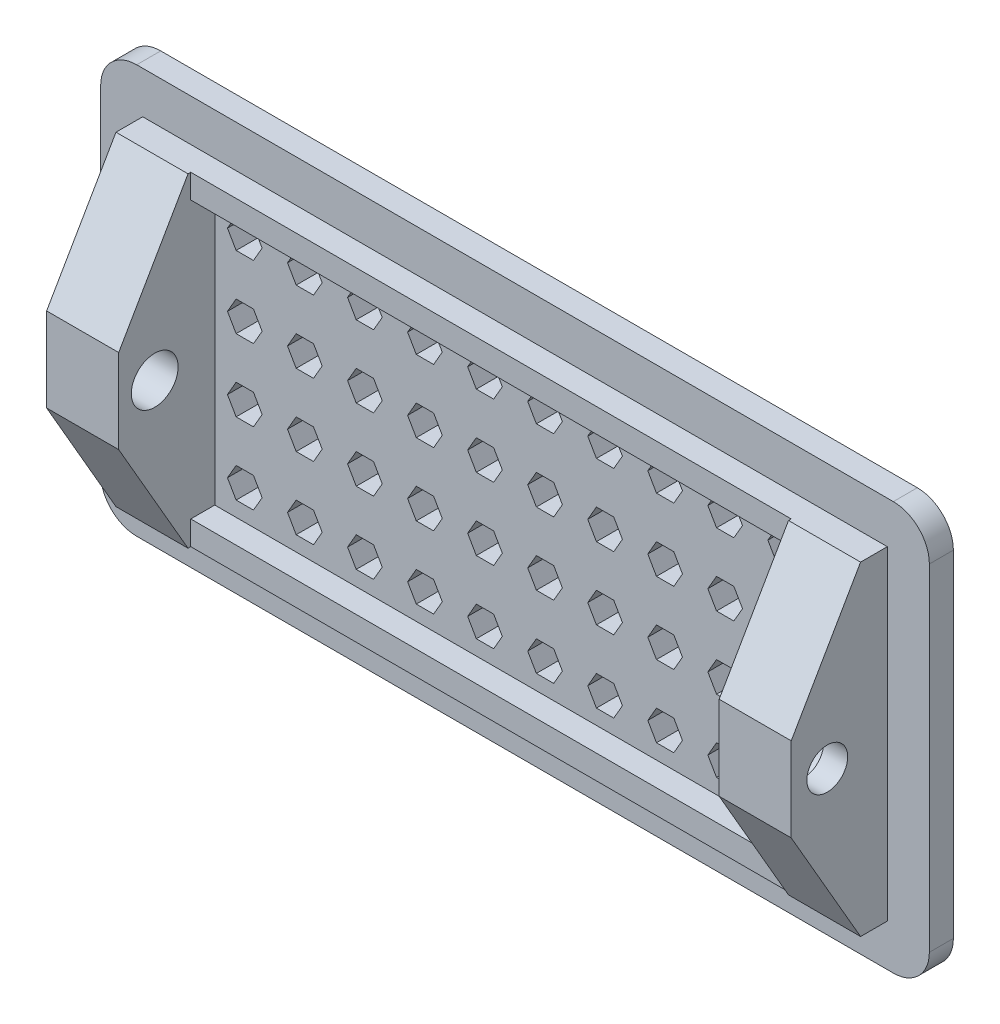
from build123d import *
from OCP.BRepFilletAPI import BRepFilletAPI_MakeChamfer

# Parameters (mm, degrees)
SKICA1_W                                          = 69
SKICA1_H                                          = 34
P_IDAT_VYSUNUT_M1_DEPTH                           = 2
SKICA2_W                                          = 50
SKICA2_H                                          = 2
P_IDAT_VYSUNUT_M2_DEPTH                           = 2
P_IDAT_VYSUNUT_M3_DEPTH                           = 8
V_LCOV_ZAHLOUBEN_PRO_M3_ROUBY_S_V_LCO_D           = 3.4
V_LCOV_ZAHLOUBEN_PRO_M3_ROUBY_S_V_LCO_DEPTH       = 6.001
V_LCOV_ZAHLOUBEN_PRO_M3_ROUBY_S_V_LCO_CBORE_D     = 3.9
V_LCOV_ZAHLOUBEN_PRO_M3_ROUBY_S_V_LCO_CBORE_DEPTH = 4
ZKOSEN_1_SIZE                                     = 10
ZKOSEN_1_SIZE2                                    = 5.773502692
ZKOSEN_2_SIZE                                     = 10
ZKOSEN_2_SIZE2                                    = 5.773502692
ZAOBLIT1_R                                        = 3
ODEBRAT_VYSUNUT_M1_DEPTH                          = 10


with BuildPart() as part:
    # Skica1 → Přidat vysunutím1 (new body)
    with BuildSketch(Plane.XY):
        Rectangle(SKICA1_W, SKICA1_H)
    extrude(amount=P_IDAT_VYSUNUT_M1_DEPTH)

    # Skica2 → Přidat vysunutím2 (add)
    with BuildSketch(Plane.XY.offset(2)):
        with Locations((0, -12.5)):
            Rectangle(SKICA2_W, SKICA2_H)
        with Locations((0, 12.5)):
            Rectangle(SKICA2_W, SKICA2_H)
    extrude(amount=P_IDAT_VYSUNUT_M2_DEPTH)

    # Skica2<3> → Přidat vysunutím3 (add)
    with BuildSketch(Plane.XY.offset(2)):
        Polygon((-25, 13.5), (-31, 13.5), (-31, -13.5), (-25, -13.5), (-25, -11.5), (-25, 11.5), align=None)
        Polygon((31, 13.5), (25, 13.5), (25, 11.5), (25, -11.5), (25, -13.5), (31, -13.5), align=None)
    extrude(amount=P_IDAT_VYSUNUT_M3_DEPTH)

    # Válcové zahloubení pro M3 šrouby s válcovou hlavou zaoblenou1
    with Locations(Plane(origin=(-25, 0, 0), x_dir=(0, 0, -1), z_dir=(1, 0, 0))):
        with Locations((-7, 0)):
            v_lcov_zahlouben_pro_m3_rouby_s_v_lco = CounterBoreHole(V_LCOV_ZAHLOUBEN_PRO_M3_ROUBY_S_V_LCO_D / 2, V_LCOV_ZAHLOUBEN_PRO_M3_ROUBY_S_V_LCO_CBORE_D / 2, V_LCOV_ZAHLOUBEN_PRO_M3_ROUBY_S_V_LCO_CBORE_DEPTH, depth=V_LCOV_ZAHLOUBEN_PRO_M3_ROUBY_S_V_LCO_DEPTH)

    # Zrcadlit1: Válcové zahloubení pro M3 šrouby s válcovou hlavou zaoblenou1 across plane
    add(v_lcov_zahlouben_pro_m3_rouby_s_v_lco.mirror(Plane(origin=(0, 0, 0), x_dir=(0, 0, 1), z_dir=(1, 0, 0))), mode=Mode.SUBTRACT)

    # Zkosení1: one chamfer whose edges measure the first distance from different faces: ONE call of the kernel's chamfer builder (chamfer() names one face for all edges)
    zkosen_1_edges_1 = [part.edges().sort_by_distance(p)[0] for p in [
        (-28, 13.5, 10),
    ]]
    zkosen_1_side_1 = [part.faces().sort_by_distance(p)[0] for p in [
        (-28, 0, 10),
    ]]
    zkosen_1_edges_2 = [part.edges().sort_by_distance(p)[0] for p in [
        (28, 13.5, 10),
    ]]
    zkosen_1_side_2 = [part.faces().sort_by_distance(p)[0] for p in [
        (28, 0, 10),
    ]]
    zkosen_1 = BRepFilletAPI_MakeChamfer(part.part.solid().wrapped)
    for e in zkosen_1_edges_1:
        zkosen_1.Add(ZKOSEN_1_SIZE, ZKOSEN_1_SIZE2, e.wrapped, zkosen_1_side_1[0].wrapped)  # the first distance lies on this face
    for e in zkosen_1_edges_2:
        zkosen_1.Add(ZKOSEN_1_SIZE, ZKOSEN_1_SIZE2, e.wrapped, zkosen_1_side_2[0].wrapped)  # the first distance lies on this face
    add(Compound.cast(zkosen_1.Shape()), mode=Mode.REPLACE)

    # Zkosení2: one chamfer whose edges measure the first distance from different faces: ONE call of the kernel's chamfer builder (chamfer() names one face for all edges)
    zkosen_2_edges_1 = [part.edges().sort_by_distance(p)[0] for p in [
        (-28, -13.5, 10),
    ]]
    zkosen_2_side_1 = [part.faces().sort_by_distance(p)[0] for p in [
        (-28, -5, 10),
    ]]
    zkosen_2_edges_2 = [part.edges().sort_by_distance(p)[0] for p in [
        (28, -13.5, 10),
    ]]
    zkosen_2_side_2 = [part.faces().sort_by_distance(p)[0] for p in [
        (28, -5, 10),
    ]]
    zkosen_2 = BRepFilletAPI_MakeChamfer(part.part.solid().wrapped)
    for e in zkosen_2_edges_1:
        zkosen_2.Add(ZKOSEN_2_SIZE, ZKOSEN_2_SIZE2, e.wrapped, zkosen_2_side_1[0].wrapped)  # the first distance lies on this face
    for e in zkosen_2_edges_2:
        zkosen_2.Add(ZKOSEN_2_SIZE, ZKOSEN_2_SIZE2, e.wrapped, zkosen_2_side_2[0].wrapped)  # the first distance lies on this face
    add(Compound.cast(zkosen_2.Shape()), mode=Mode.REPLACE)

    # Zaoblit1
    zaoblit1_edges = [part.edges().sort_by_distance(p)[0] for p in [
        (34.5, -17, 1),
        (-34.5, -17, 1),
        (-34.5, 17, 1),
        (34.5, 17, 1),
    ]]
    fillet(zaoblit1_edges, radius=ZAOBLIT1_R)

    # Skica9 → Odebrat vysunutím1 (cut)
    with BuildSketch(Plane.XY.offset(2)):
        Polygon((-21.056624327, -9), (-21.778312164, -7.75), (-23.221687836, -7.75), (-23.943375673, -9), (-23.221687836, -10.25), (-21.778312164, -10.25), align=None)
        Polygon((-16.056624327, -9), (-16.778312164, -7.75), (-18.221687836, -7.75), (-18.943375673, -9), (-18.221687836, -10.25), (-16.778312164, -10.25), align=None)
        Polygon((-11.056624327, -9), (-11.778312164, -7.75), (-13.221687836, -7.75), (-13.943375673, -9), (-13.221687836, -10.25), (-11.778312164, -10.25), align=None)
        Polygon((-6.056624327, -9), (-6.778312164, -7.75), (-8.221687836, -7.75), (-8.943375673, -9), (-8.221687836, -10.25), (-6.778312164, -10.25), align=None)
        Polygon((-1.056624327, -9), (-1.778312164, -7.75), (-3.221687836, -7.75), (-3.943375673, -9), (-3.221687836, -10.25), (-1.778312164, -10.25), align=None)
        Polygon((3.943375673, -9), (3.221687836, -7.75), (1.778312164, -7.75), (1.056624327, -9), (1.778312164, -10.25), (3.221687836, -10.25), align=None)
        Polygon((8.943375673, -9), (8.221687836, -7.75), (6.778312164, -7.75), (6.056624327, -9), (6.778312164, -10.25), (8.221687836, -10.25), align=None)
        Polygon((13.943375673, -9), (13.221687836, -7.75), (11.778312164, -7.75), (11.056624327, -9), (11.778312164, -10.25), (13.221687836, -10.25), align=None)
        Polygon((18.943375673, -9), (18.221687836, -7.75), (16.778312164, -7.75), (16.056624327, -9), (16.778312164, -10.25), (18.221687836, -10.25), align=None)
        Polygon((23.943375673, -9), (23.221687836, -7.75), (21.778312164, -7.75), (21.056624327, -9), (21.778312164, -10.25), (23.221687836, -10.25), align=None)
        Polygon((-16.056624327, -3), (-16.778312164, -1.75), (-18.221687836, -1.75), (-18.943375673, -3), (-18.221687836, -4.25), (-16.778312164, -4.25), align=None)
        Polygon((-11.056624327, -3), (-11.778312164, -1.75), (-13.221687836, -1.75), (-13.943375673, -3), (-13.221687836, -4.25), (-11.778312164, -4.25), align=None)
        Polygon((-6.056624327, -3), (-6.778312164, -1.75), (-8.221687836, -1.75), (-8.943375673, -3), (-8.221687836, -4.25), (-6.778312164, -4.25), align=None)
        Polygon((-1.056624327, -3), (-1.778312164, -1.75), (-3.221687836, -1.75), (-3.943375673, -3), (-3.221687836, -4.25), (-1.778312164, -4.25), align=None)
        Polygon((3.943375673, -3), (3.221687836, -1.75), (1.778312164, -1.75), (1.056624327, -3), (1.778312164, -4.25), (3.221687836, -4.25), align=None)
        Polygon((8.943375673, -3), (8.221687836, -1.75), (6.778312164, -1.75), (6.056624327, -3), (6.778312164, -4.25), (8.221687836, -4.25), align=None)
        Polygon((13.943375673, -3), (13.221687836, -1.75), (11.778312164, -1.75), (11.056624327, -3), (11.778312164, -4.25), (13.221687836, -4.25), align=None)
        Polygon((18.943375673, -3), (18.221687836, -1.75), (16.778312164, -1.75), (16.056624327, -3), (16.778312164, -4.25), (18.221687836, -4.25), align=None)
        Polygon((23.943375673, -3), (23.221687836, -1.75), (21.778312164, -1.75), (21.056624327, -3), (21.778312164, -4.25), (23.221687836, -4.25), align=None)
        Polygon((-16.056624327, 3), (-16.778312164, 4.25), (-18.221687836, 4.25), (-18.943375673, 3), (-18.221687836, 1.75), (-16.778312164, 1.75), align=None)
        Polygon((-11.056624327, 3), (-11.778312164, 4.25), (-13.221687836, 4.25), (-13.943375673, 3), (-13.221687836, 1.75), (-11.778312164, 1.75), align=None)
        Polygon((-6.056624327, 3), (-6.778312164, 4.25), (-8.221687836, 4.25), (-8.943375673, 3), (-8.221687836, 1.75), (-6.778312164, 1.75), align=None)
        Polygon((-1.056624327, 3), (-1.778312164, 4.25), (-3.221687836, 4.25), (-3.943375673, 3), (-3.221687836, 1.75), (-1.778312164, 1.75), align=None)
        Polygon((3.943375673, 3), (3.221687836, 4.25), (1.778312164, 4.25), (1.056624327, 3), (1.778312164, 1.75), (3.221687836, 1.75), align=None)
        Polygon((8.943375673, 3), (8.221687836, 4.25), (6.778312164, 4.25), (6.056624327, 3), (6.778312164, 1.75), (8.221687836, 1.75), align=None)
        Polygon((13.943375673, 3), (13.221687836, 4.25), (11.778312164, 4.25), (11.056624327, 3), (11.778312164, 1.75), (13.221687836, 1.75), align=None)
        Polygon((18.943375673, 3), (18.221687836, 4.25), (16.778312164, 4.25), (16.056624327, 3), (16.778312164, 1.75), (18.221687836, 1.75), align=None)
        Polygon((23.943375673, 3), (23.221687836, 4.25), (21.778312164, 4.25), (21.056624327, 3), (21.778312164, 1.75), (23.221687836, 1.75), align=None)
        Polygon((-16.056624327, 9), (-16.778312164, 10.25), (-18.221687836, 10.25), (-18.943375673, 9), (-18.221687836, 7.75), (-16.778312164, 7.75), align=None)
        Polygon((-11.056624327, 9), (-11.778312164, 10.25), (-13.221687836, 10.25), (-13.943375673, 9), (-13.221687836, 7.75), (-11.778312164, 7.75), align=None)
        Polygon((-6.056624327, 9), (-6.778312164, 10.25), (-8.221687836, 10.25), (-8.943375673, 9), (-8.221687836, 7.75), (-6.778312164, 7.75), align=None)
        Polygon((-1.056624327, 9), (-1.778312164, 10.25), (-3.221687836, 10.25), (-3.943375673, 9), (-3.221687836, 7.75), (-1.778312164, 7.75), align=None)
        Polygon((3.943375673, 9), (3.221687836, 10.25), (1.778312164, 10.25), (1.056624327, 9), (1.778312164, 7.75), (3.221687836, 7.75), align=None)
        Polygon((8.943375673, 9), (8.221687836, 10.25), (6.778312164, 10.25), (6.056624327, 9), (6.778312164, 7.75), (8.221687836, 7.75), align=None)
        Polygon((13.943375673, 9), (13.221687836, 10.25), (11.778312164, 10.25), (11.056624327, 9), (11.778312164, 7.75), (13.221687836, 7.75), align=None)
        Polygon((18.943375673, 9), (18.221687836, 10.25), (16.778312164, 10.25), (16.056624327, 9), (16.778312164, 7.75), (18.221687836, 7.75), align=None)
        Polygon((23.943375673, 9), (23.221687836, 10.25), (21.778312164, 10.25), (21.056624327, 9), (21.778312164, 7.75), (23.221687836, 7.75), align=None)
        Polygon((-21.056624327, -3), (-21.778312164, -1.75), (-23.221687836, -1.75), (-23.943375673, -3), (-23.221687836, -4.25), (-21.778312164, -4.25), align=None)
        Polygon((-21.056624327, 3), (-21.778312164, 4.25), (-23.221687836, 4.25), (-23.943375673, 3), (-23.221687836, 1.75), (-21.778312164, 1.75), align=None)
        Polygon((-21.056624327, 9), (-21.778312164, 10.25), (-23.221687836, 10.25), (-23.943375673, 9), (-23.221687836, 7.75), (-21.778312164, 7.75), align=None)
    extrude(amount=-ODEBRAT_VYSUNUT_M1_DEPTH, mode=Mode.SUBTRACT)


solid = part.part
